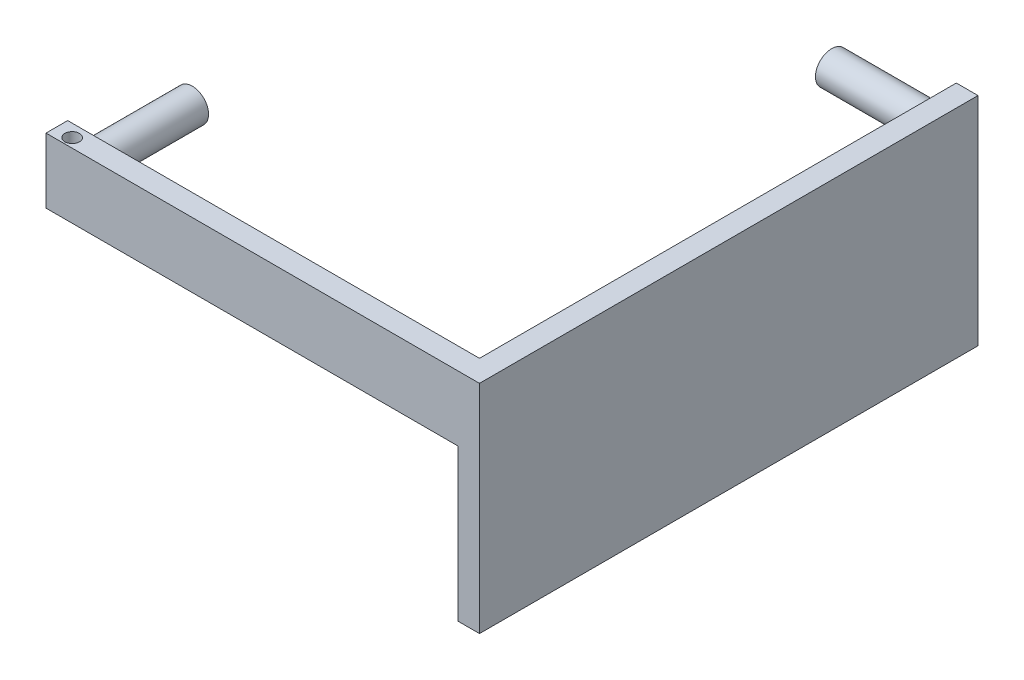
from build123d import *

# Parameters (mm, degrees)
BODY_DEPTH          = 30
SKETCH2_R           = 7.5
ROTATING_PIN_DEPTH  = 50
SKETCH3_R           = 7.5
BOSS_EXTRUDE3_DEPTH = 50
SKETCH4_W           = 10
SKETCH4_H           = 100
BOSS_EXTRUDE4_DEPTH = 230
SKETCH5_R           = 7.5
BOSS_EXTRUDE5_DEPTH = 50
SKETCH6_R           = 3.378341257
CUT_EXTRUDE1_DEPTH  = 10


with BuildPart() as part:
    # Sketch1 → body (new body)
    with BuildSketch(Plane(origin=(0, 0, 0), x_dir=(1, 0, 0), z_dir=(0, 1, 0))):
        Polygon((0, 0), (200, 0), (200, 230), (190, 230), (190, 10), (0, 10), align=None)
    extrude(amount=BODY_DEPTH)

    # Sketch2 → rotating pin (add)
    with BuildSketch(Plane(origin=(0, 0, -10), x_dir=(-1, 0, 0), z_dir=(0, 0, -1))):
        with Locations((-7.5, 15)):
            Circle(SKETCH2_R)
    extrude(amount=ROTATING_PIN_DEPTH)

    # Sketch3 → Boss-Extrude3 (add)
    with BuildSketch(Plane.ZY.offset(-190)):
        with Locations(Location((-222.5, 15, 0), (0, 0, 180))):
            Circle(SKETCH3_R)
    extrude(amount=BOSS_EXTRUDE3_DEPTH)

    # Sketch4 → Boss-Extrude4 (add, through all)
    with BuildSketch(Plane.XY):
        with Locations((195, -20)):
            Rectangle(SKETCH4_W, SKETCH4_H)
    extrude(amount=-BOSS_EXTRUDE4_DEPTH)

    # Sketch5 → Boss-Extrude5 (add)
    with BuildSketch(Plane.ZY.offset(-190)):
        with Locations(Location((-222.5, -55, 0), (0, 0, 180))):
            Circle(SKETCH5_R)
    extrude(amount=BOSS_EXTRUDE5_DEPTH)

    # Sketch6 → Cut-Extrude1 (cut)
    with BuildSketch(Plane(origin=(0, 30, 0), x_dir=(1, 0, 0), z_dir=(0, 1, 0))):
        with Locations(Location((7.831461534, 4.216291967, 0), (0, 0, 270))):
            Circle(SKETCH6_R)
    extrude(amount=-CUT_EXTRUDE1_DEPTH, mode=Mode.SUBTRACT)


solid = part.part
